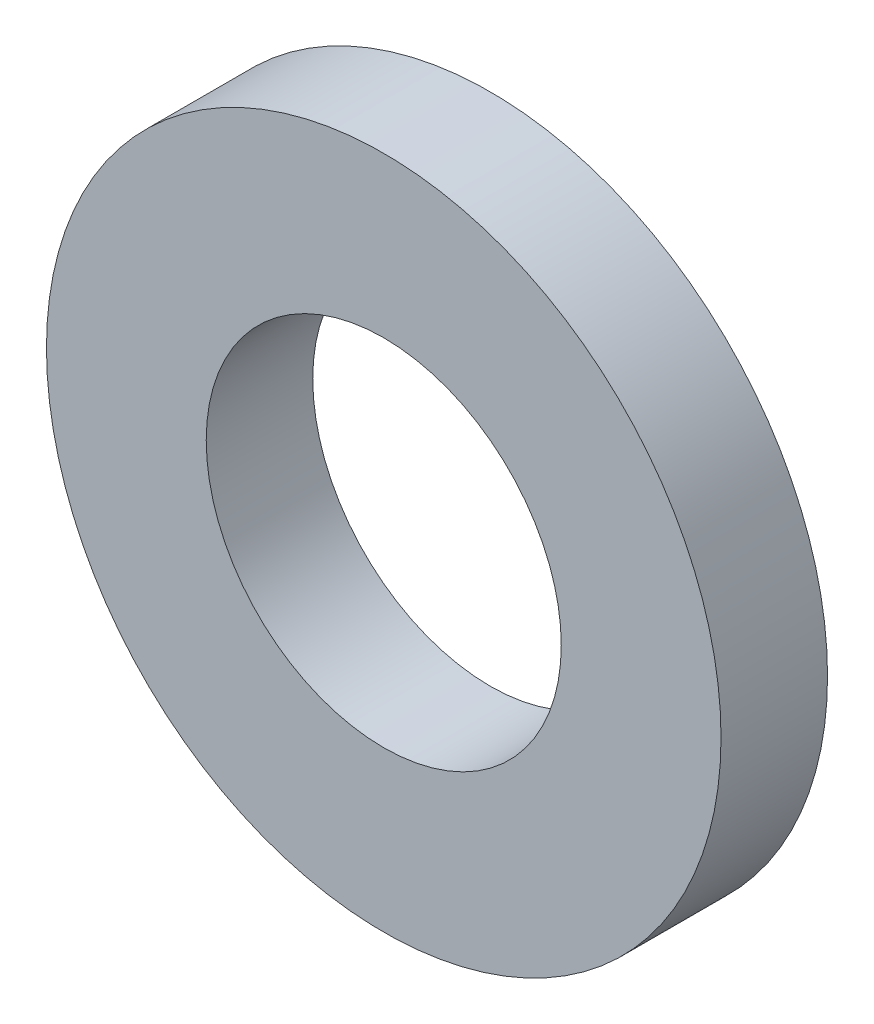
from build123d import *

# Parameters (mm, degrees)
SKETCH1_R           = 9.5
SKETCH1_R_2         = 5
BOSS_EXTRUDE1_DEPTH = 1.5


with BuildPart() as part:
    # Sketch1 → Boss-Extrude1 (new, symmetric)
    with BuildSketch(Plane.XY):
        Circle(SKETCH1_R)
        Circle(SKETCH1_R_2, mode=Mode.SUBTRACT)
    extrude(amount=BOSS_EXTRUDE1_DEPTH, both=True)


solid = part.part
